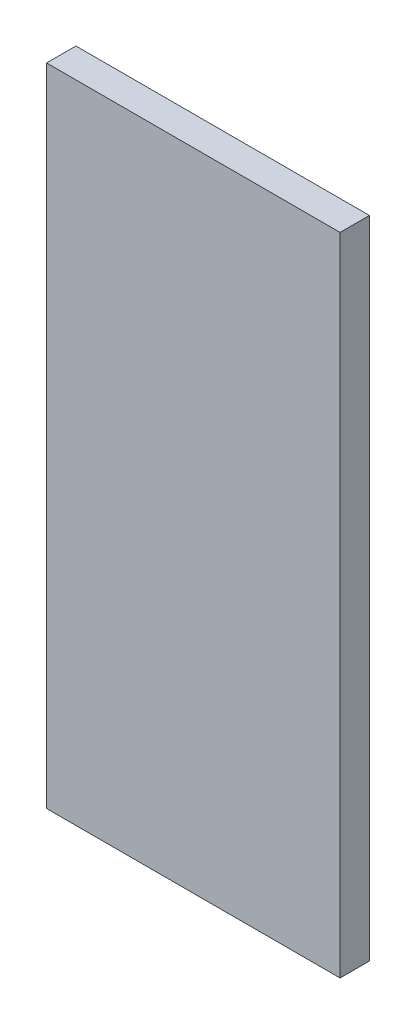
from build123d import *

# Parameters (mm, degrees)
SKETCH1_W           = 127
SKETCH1_H           = 279.4
BOSS_EXTRUDE1_DEPTH = 12.7


with BuildPart() as part:
    # Sketch1 → Boss-Extrude1 (new body)
    with BuildSketch(Plane.XY):
        with Locations((63.5, 139.7)):
            Rectangle(SKETCH1_W, SKETCH1_H)
    extrude(amount=BOSS_EXTRUDE1_DEPTH)


solid = part.part
